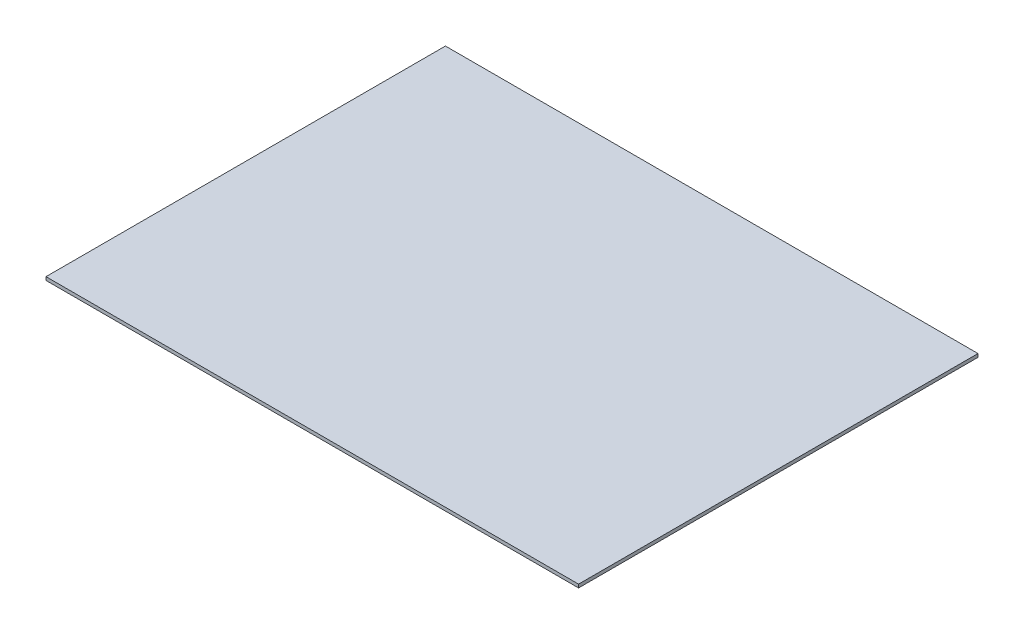
from build123d import *

# Parameters (mm, degrees)
SKETCH2_W           = 160
SKETCH2_H           = 120
BOSS_EXTRUDE1_DEPTH = 1


with BuildPart() as part:
    # Sketch2 → Boss-Extrude1 (new body)
    with BuildSketch(Plane(origin=(0, 0, 0), x_dir=(1, 0, 0), z_dir=(0, 1, 0))):
        Rectangle(SKETCH2_W, SKETCH2_H)
    extrude(amount=BOSS_EXTRUDE1_DEPTH)


solid = part.part
